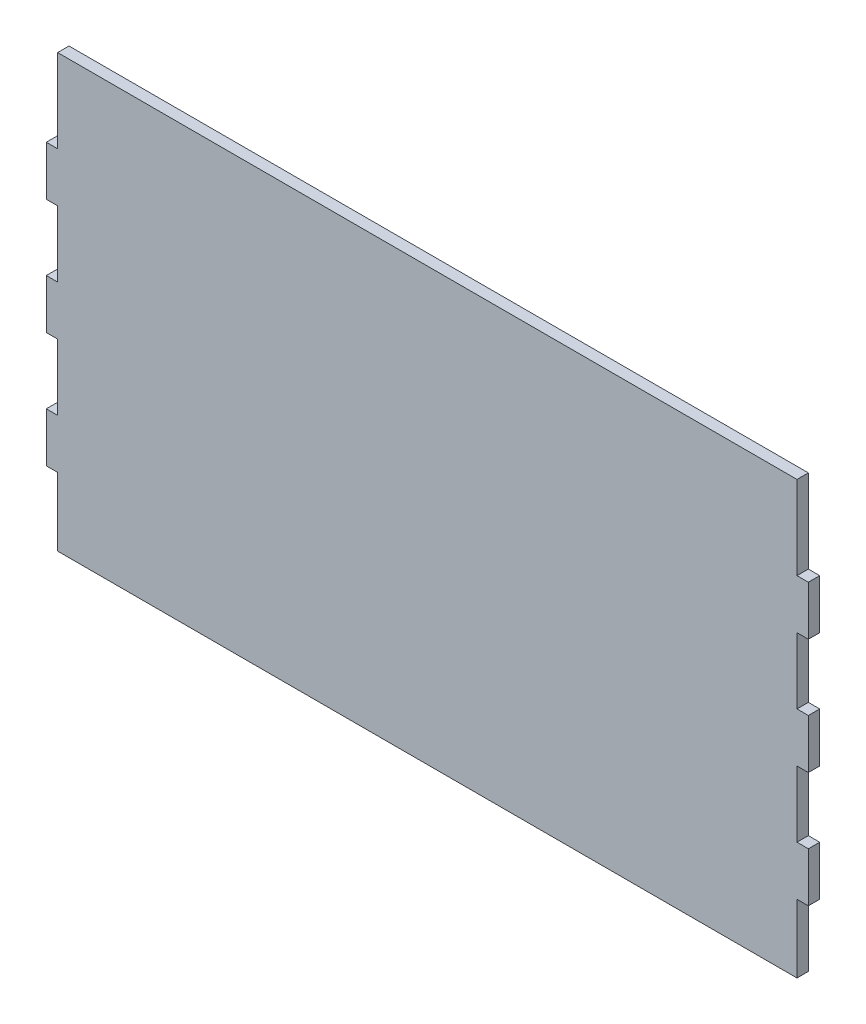
from build123d import *

# Parameters (mm, degrees)
CROQUIS1_W              = 201.2
CROQUIS1_H              = 110
SALIENTE_EXTRUIR1_DEPTH = 3
CROQUIS2_W              = 3
CROQUIS2_H              = 17.427708433
CORTAR_EXTRUIR1_DEPTH   = 3
CROQUIS4_W              = 195.2
CROQUIS4_H              = 4
SALIENTE_EXTRUIR3_DEPTH = 3
CROQUIS6_W              = 3.205128205
CROQUIS6_H              = 25
CORTAR_EXTRUIR4_DEPTH   = 1.5


with BuildPart() as part:
    # Croquis1 → Saliente-Extruir1 (new body)
    with BuildSketch(Plane.XY):
        Rectangle(CROQUIS1_W, CROQUIS1_H)
    extrude(amount=SALIENTE_EXTRUIR1_DEPTH)

    # Croquis2 → Cortar-Extruir1 (cut)
    with BuildSketch(Plane.XY.offset(3)):
        Polygon((-100.6, 55), (-100.6, 37), (-97.6, 37), (-97.6, 52), (-97.6, 55), align=None)
        with Locations((-99.1, 15.237951406)):
            Rectangle(CROQUIS2_W, CROQUIS2_H)
        Polygon((97.6, 55), (97.6, 52), (97.6, 37), (100.6, 37), (100.6, 55), align=None)
        with Locations((99.1, 15.237951406)):
            Rectangle(CROQUIS2_W, CROQUIS2_H)
        with Locations((99.1, -15.237951406)):
            Rectangle(CROQUIS2_W, CROQUIS2_H)
        Polygon((97.6, -37), (97.6, -52), (97.6, -55), (100.6, -55), (100.6, -37), align=None)
        with Locations((-99.1, -15.237951406)):
            Rectangle(CROQUIS2_W, CROQUIS2_H)
        Polygon((-97.6, -37), (-100.6, -37), (-100.6, -55), (-97.6, -55), (-97.6, -52), align=None)
    extrude(amount=-CORTAR_EXTRUIR1_DEPTH, mode=Mode.SUBTRACT)

    # Croquis4 → Saliente-Extruir3 (add)
    with BuildSketch(Plane(origin=(0, 0, 0), x_dir=(-1, 0, 0), z_dir=(0, 0, -1))):
        with Locations((0, 57)):
            Rectangle(CROQUIS4_W, CROQUIS4_H)
    extrude(amount=-SALIENTE_EXTRUIR3_DEPTH)

    # Croquis6 → Cortar-Extruir4 (cut)
    # profile 1 of 4: a face of its own
    with BuildSketch(Plane(origin=(0, 0, 0), x_dir=(-1, 0, 0), z_dir=(0, 0, -1))):
        with Locations((-55.769230769, 1.792158121)):
            Rectangle(CROQUIS6_W, CROQUIS6_H)
    # profile 2 of 4: a face of its own
    with BuildSketch(Plane(origin=(0, 0, 0), x_dir=(-1, 0, 0), z_dir=(0, 0, -1))):
        Polygon((-50, 11.728055557), (-50, 14.292158121), (-31.41025641, 14.292158121), (-31.41025641, 11.728055557), (-39.102564103, 11.728055557), (-39.102564103, -10.707841879), (-42.307692308, -10.707841879), (-42.307692308, 11.728055557), align=None)
    # profile 3 of 4: a face of its own
    with BuildSketch(Plane(origin=(0, 0, 0), x_dir=(-1, 0, 0), z_dir=(0, 0, -1))):
        Polygon((-12.179487179, 14.292158121), (3.846153846, -10.707841879), (0.310496795, -10.707841879), (-4.827724359, -2.695021367), (-20.177283654, -2.695021367), (-25.305488782, -10.707841879), (-28.846153846, -10.707841879), (-12.820512821, 14.292158121), align=None)
        Polygon((-12.5, 9.279137287), (-18.529647436, -0.130918802), (-6.470352564, -0.130918802), align=None, mode=Mode.SUBTRACT)
    # profile 4 of 4: a face of its own
    with BuildSketch(Plane(origin=(0, 0, 0), x_dir=(-1, 0, 0), z_dir=(0, 0, -1))):
        Polygon((7.692307692, -10.707841879), (12.329727564, 14.292158121), (13.090945513, 14.292158121), (26.762820513, -6.220662392), (40.389623397, 14.292158121), (41.17588141, 14.292158121), (45.833333333, -10.707841879), (42.608173077, -10.707841879), (39.262820513, 7.240876069), (27.338741987, -10.707841879), (26.231971154, -10.707841879), (14.262820513, 7.240876069), (10.932491987, -10.707841879), align=None)
    extrude(amount=-CORTAR_EXTRUIR4_DEPTH, mode=Mode.SUBTRACT)


solid = part.part
